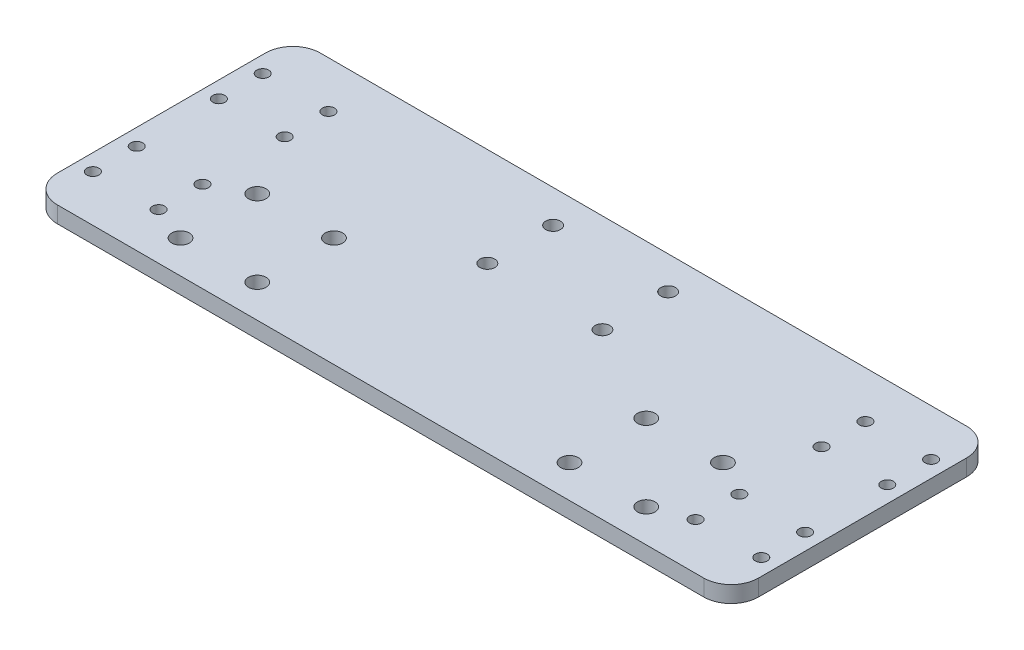
from build123d import *

# Parameters (mm, degrees)
SKETCH_1_R          = 1.1
EXTRUDE_1_DEPTH     = 3
SKETCH_2_R          = 1.6
CUT_EXTRUDE_1_DEPTH = 137.736973785
SKETCH_5_R          = 1.35
CUT_EXTRUDE_3_DEPTH = 137.736973785
FILLET_1_R          = 5


with BuildPart() as part:
    # 草图1 → 凸台-拉伸1 (new body)
    with BuildSketch(Plane(origin=(0, 0, 0), x_dir=(1, 0, 0), z_dir=(0, 1, 0))):
        Polygon((0, 0), (128, 0), (128, 48), (110, 48), (18, 48), (0, 48), align=None)
        with Locations(Location((125, 8.5, 0), (0, 0, 270))):
            Circle(SKETCH_1_R, mode=Mode.SUBTRACT)
        with Locations(Location((113, 8.5, 0), (0, 0, 270))):
            Circle(SKETCH_1_R, mode=Mode.SUBTRACT)
        with Locations(Location((125, 16.5, 0), (0, 0, 270))):
            Circle(SKETCH_1_R, mode=Mode.SUBTRACT)
        with Locations(Location((113, 16.5, 0), (0, 0, 270))):
            Circle(SKETCH_1_R, mode=Mode.SUBTRACT)
        with Locations(Location((125, 31.5, 0), (0, 0, 90))):
            Circle(SKETCH_1_R, mode=Mode.SUBTRACT)
        with Locations(Location((125, 39.5, 0), (0, 0, 90))):
            Circle(SKETCH_1_R, mode=Mode.SUBTRACT)
        with Locations(Location((113, 39.5, 0), (0, 0, 90))):
            Circle(SKETCH_1_R, mode=Mode.SUBTRACT)
        with Locations(Location((113, 31.5, 0), (0, 0, 90))):
            Circle(SKETCH_1_R, mode=Mode.SUBTRACT)
        with Locations(Location((15, 8.5, 0), (0, 0, 90))):
            Circle(SKETCH_1_R, mode=Mode.SUBTRACT)
        with Locations(Location((3, 8.5, 0), (0, 0, 90))):
            Circle(SKETCH_1_R, mode=Mode.SUBTRACT)
        with Locations(Location((3, 16.5, 0), (0, 0, 90))):
            Circle(SKETCH_1_R, mode=Mode.SUBTRACT)
        with Locations(Location((15, 16.5, 0), (0, 0, 90))):
            Circle(SKETCH_1_R, mode=Mode.SUBTRACT)
        with Locations(Location((15, 39.5, 0), (0, 0, 270))):
            Circle(SKETCH_1_R, mode=Mode.SUBTRACT)
        with Locations(Location((3, 39.5, 0), (0, 0, 270))):
            Circle(SKETCH_1_R, mode=Mode.SUBTRACT)
        with Locations(Location((3, 31.5, 0), (0, 0, 270))):
            Circle(SKETCH_1_R, mode=Mode.SUBTRACT)
        with Locations(Location((15, 31.5, 0), (0, 0, 270))):
            Circle(SKETCH_1_R, mode=Mode.SUBTRACT)
    extrude(amount=EXTRUDE_1_DEPTH)

    # 草图2 → 切除-拉伸1 (cut, through all)
    with BuildSketch(Plane(origin=(0, 3, 0), x_dir=(1, 0, 0), z_dir=(0, 1, 0))):
        with Locations(Location((21.5, 20, 0), (0, 0, 270))):
            Circle(SKETCH_2_R)
        with Locations(Location((35.5, 20, 0), (0, 0, 270))):
            Circle(SKETCH_2_R)
        with Locations(Location((35.5, 6, 0), (0, 0, 270))):
            Circle(SKETCH_2_R)
        with Locations(Location((21.5, 6, 0), (0, 0, 270))):
            Circle(SKETCH_2_R)
        with Locations(Location((106.5, 6, 0), (0, 0, 90))):
            Circle(SKETCH_2_R)
        with Locations(Location((92.5, 6, 0), (0, 0, 90))):
            Circle(SKETCH_2_R)
        with Locations(Location((92.5, 20, 0), (0, 0, 90))):
            Circle(SKETCH_2_R)
        with Locations(Location((106.5, 20, 0), (0, 0, 90))):
            Circle(SKETCH_2_R)
    extrude(amount=-CUT_EXTRUDE_1_DEPTH, mode=Mode.SUBTRACT)

    # 草图5 → 切除-拉伸3 (cut, through all)
    with BuildSketch(Plane(origin=(0, 3, 0), x_dir=(1, 0, 0), z_dir=(0, 1, 0))):
        with Locations(Location((53.5, 42, 0), (0, 0, 270))):
            Circle(SKETCH_5_R)
        with Locations(Location((74.5, 42, 0), (0, 0, 90))):
            Circle(SKETCH_5_R)
        with Locations(Location((74.5, 30, 0), (0, 0, 270))):
            Circle(SKETCH_5_R)
        with Locations(Location((53.5, 30, 0), (0, 0, 90))):
            Circle(SKETCH_5_R)
    extrude(amount=-CUT_EXTRUDE_3_DEPTH, mode=Mode.SUBTRACT)

    # 圆角1
    fillet_1_edges = [part.edges().sort_by_distance(p)[0] for p in [
        (0, 1.5, -48),
        (128, 1.5, -48),
        (128, 1.5, 0),
        (0, 1.5, 0),
    ]]
    fillet(fillet_1_edges, radius=FILLET_1_R)


solid = part.part
